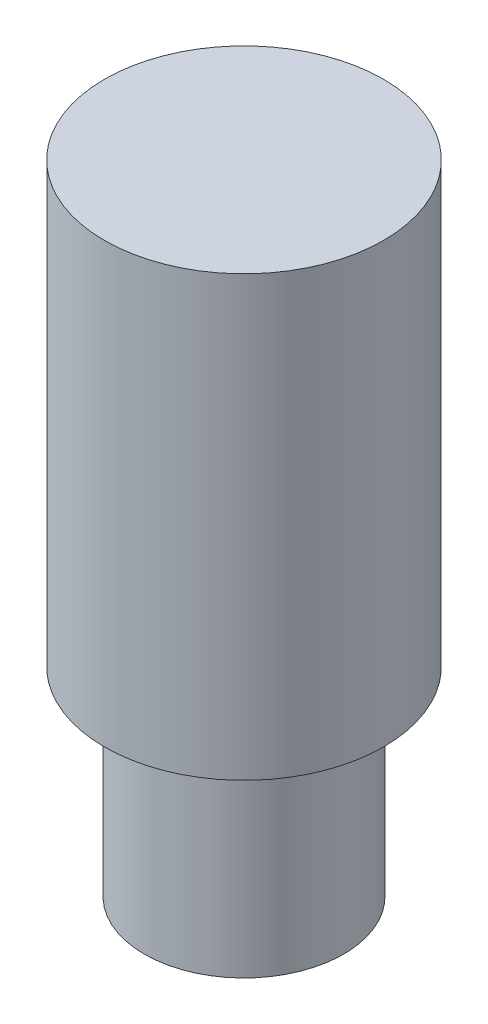
from build123d import *

# Parameters (mm, degrees)
SKETCH1_R           = 2.5
BOSS_EXTRUDE1_DEPTH = 5
SKETCH2_R           = 3.5
BOSS_EXTRUDE2_DEPTH = 11


with BuildPart() as part:
    # Sketch1 → Boss-Extrude1 (new body)
    with BuildSketch(Plane(origin=(0, 0, 0), x_dir=(1, 0, 0), z_dir=(0, 1, 0))):
        with Locations(Location((0, 0, 0), (0, 0, 270))):
            Circle(SKETCH1_R)
    extrude(amount=BOSS_EXTRUDE1_DEPTH)

    # Sketch7 → CSK for M2 Oval Head Machine Screw2 (revolve, cut)
    with BuildSketch(Plane(origin=(0, 0, 0), x_dir=(0, 0, -1), z_dir=(1, 0, 0))):
        Polygon((0, 0), (0, 5), (1.225, 5), (1.2, 4.975), (1.2, 1), (2.2, 0), align=None)
    revolve(axis=Axis((0, -6.35, 0), (0, 1, 0)), mode=Mode.SUBTRACT)

    # Sketch2 → Boss-Extrude2 (add)
    with BuildSketch(Plane(origin=(0, 5, 0), x_dir=(1, 0, 0), z_dir=(0, 1, 0))):
        with Locations(Location((0, 0, 0), (0, 0, 270))):
            Circle(SKETCH2_R)
    extrude(amount=BOSS_EXTRUDE2_DEPTH)


solid = part.part
